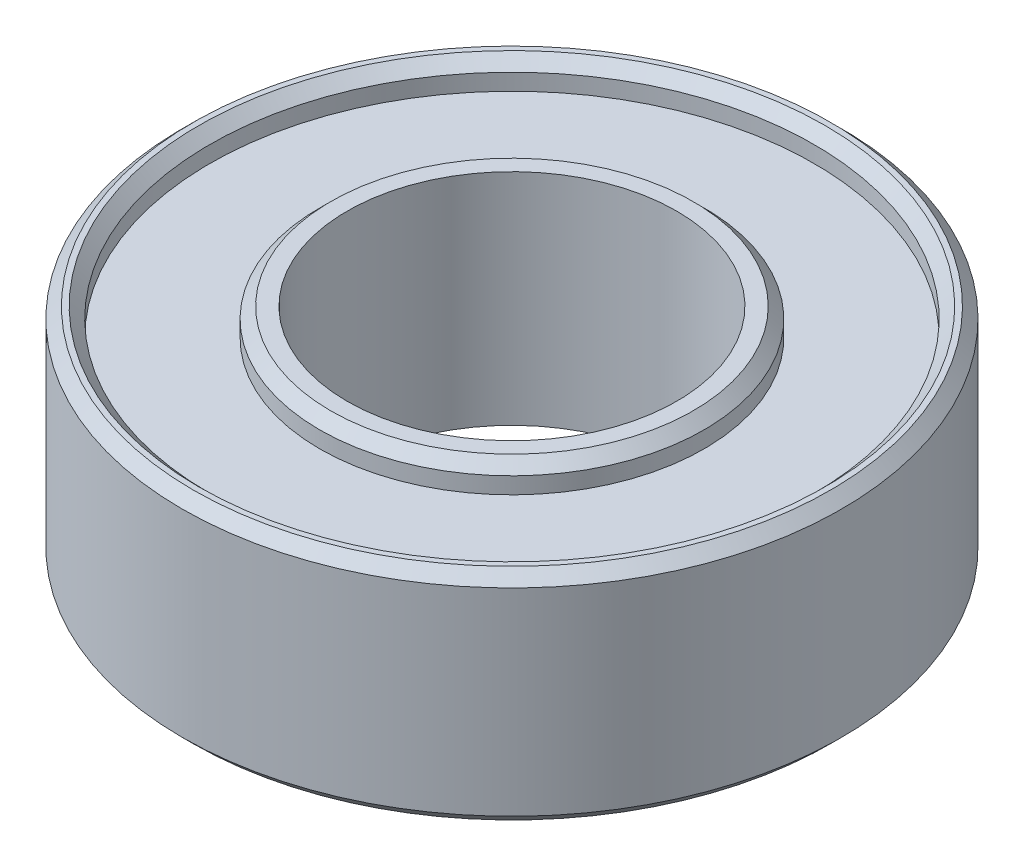
from build123d import *

# Parameters (mm, degrees)
SKETCH_1_R          = 3
EXTRUDE_1_DEPTH     = 2
SKETCH_2_R          = 1.5
CUT_EXTRUDE_1_DEPTH = 2
CUT_EXTRUDE_START   = 2
SKETCH_3_R          = 2.75
SKETCH_3_R_2        = 1.75
CUT_EXTRUDE_2_DEPTH = 0.25
CUT_EXTRUDE_START_2 = 0.25
SKETCH_4_R          = 2.75
SKETCH_4_R_2        = 1.75
CUT_EXTRUDE_3_DEPTH = 0.25
CHAMFER_1_SIZE      = 0.1


with BuildPart() as part:
    # 草图1 → 凸台-拉伸1 (new body)
    with BuildSketch(Plane(origin=(0, 0, 0), x_dir=(1, 0, 0), z_dir=(0, 1, 0))):
        with Locations(Location((0, 0, 0), (0, 0, 270))):
            Circle(SKETCH_1_R)
    extrude(amount=EXTRUDE_1_DEPTH)

    # 草图2 → 切除-拉伸1 (cut)
    with BuildSketch(Plane(origin=(0, 0, 0), x_dir=(1, 0, 0), z_dir=(0, 1, 0))):
        with Locations(Location((0, 0, 0), (0, 0, 270))):
            Circle(SKETCH_2_R)
    extrude(amount=CUT_EXTRUDE_1_DEPTH, mode=Mode.SUBTRACT)

    # 草图3 → 切除-拉伸2 (cut)
    with BuildSketch(Plane(origin=(0, 0, 0), x_dir=(1, 0, 0), z_dir=(0, 1, 0)).offset(CUT_EXTRUDE_START)):
        with Locations(Location((0, 0, 0), (0, 0, 270))):
            Circle(SKETCH_3_R)
        with Locations(Location((0, 0, 0), (0, 0, 270))):
            Circle(SKETCH_3_R_2, mode=Mode.SUBTRACT)
    extrude(amount=-CUT_EXTRUDE_2_DEPTH, mode=Mode.SUBTRACT)

    # 草图4 → 切除-拉伸3 (cut)
    with BuildSketch(Plane(origin=(0, 0, 0), x_dir=(1, 0, 0), z_dir=(0, 1, 0)).offset(CUT_EXTRUDE_START_2)):
        with Locations(Location((0, 0, 0), (0, 0, 270))):
            Circle(SKETCH_4_R)
        with Locations(Location((0, 0, 0), (0, 0, 270))):
            Circle(SKETCH_4_R_2, mode=Mode.SUBTRACT)
    extrude(amount=-CUT_EXTRUDE_3_DEPTH, mode=Mode.SUBTRACT)

    # 倒角1
    chamfer_1_edges = [part.edges().sort_by_distance(p)[0] for p in [
        (0, 2, -2.75),
        (0, 2, -1.75),
        (0, 0, -1.75),
        (0, 0, -2.75),
        (0, 0, -3),
        (0, 2, -3),
    ]]
    chamfer(chamfer_1_edges, length=CHAMFER_1_SIZE)


solid = part.part
